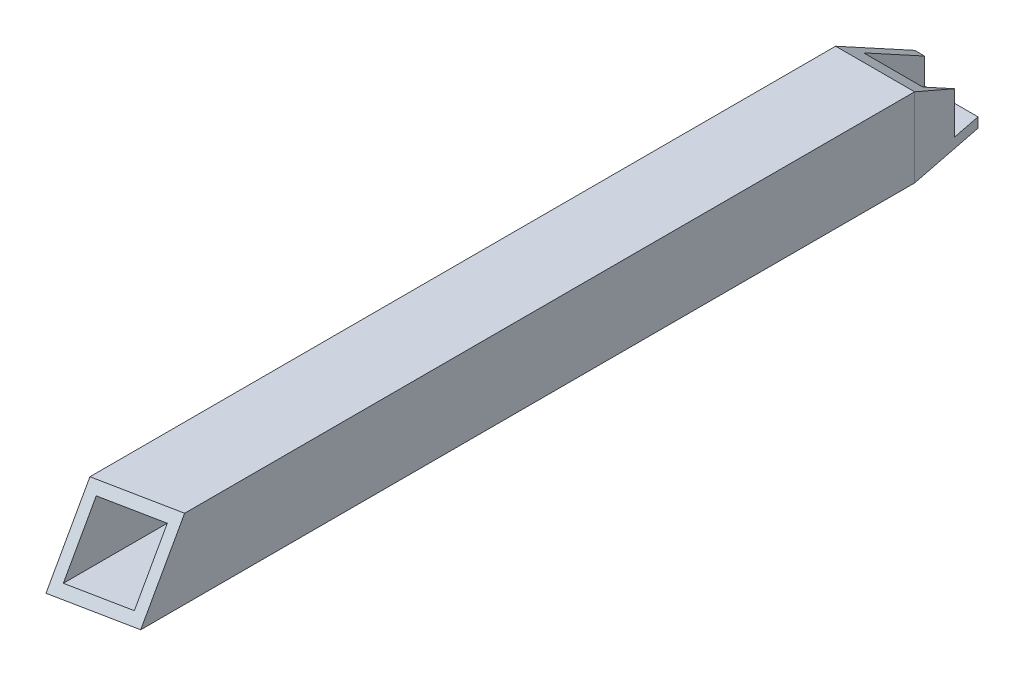
from build123d import *

# Parameters (mm, degrees)
BOSS_EXTRUDE1_DEPTH      = 139.7
BOSS_EXTRUDE1_DEPTH_BACK = 139.7
SKETCH3_W                = 25.4
SKETCH3_H                = 25.4
SKETCH3_W_2              = 19.05
SKETCH3_H_2              = 19.05


with BuildPart() as part:
    # Sketch3 → Boss-Extrude1 (new, two sides: drawn at the far end of the back side and taken through both)
    with BuildSketch(Plane.XY.offset(-BOSS_EXTRUDE1_DEPTH_BACK)):
        Rectangle(SKETCH3_W, SKETCH3_H)
        Rectangle(SKETCH3_W_2, SKETCH3_H_2, mode=Mode.SUBTRACT)
    extrude(amount=BOSS_EXTRUDE1_DEPTH + BOSS_EXTRUDE1_DEPTH_BACK)

    # SurfaceCut2
    split(bisect_by=Plane(origin=(19.203056865, 53.641884581, 96.452303833), x_dir=(0.9807512157806098, 0, -0.1952614983678451), z_dir=(0.17141995510435715, 0.47884508758591265, 0.8610009181684186)), keep=Keep.BOTTOM)

    # SurfaceCut4
    split(bisect_by=Plane(origin=(34.104573835, 0, -6.790009618), x_dir=(0, 1, 0), z_dir=(0.9807512157806096, 0, -0.19526149836784543)), keep=Keep.BOTTOM)

    # SurfaceCut5
    split(bisect_by=Plane(origin=(0, 57.817850163, -31.536407322), x_dir=(1, 0, 0), z_dir=(0, 0.8778994145657232, -0.47884508758591277)), keep=Keep.BOTTOM)


solid = part.part
